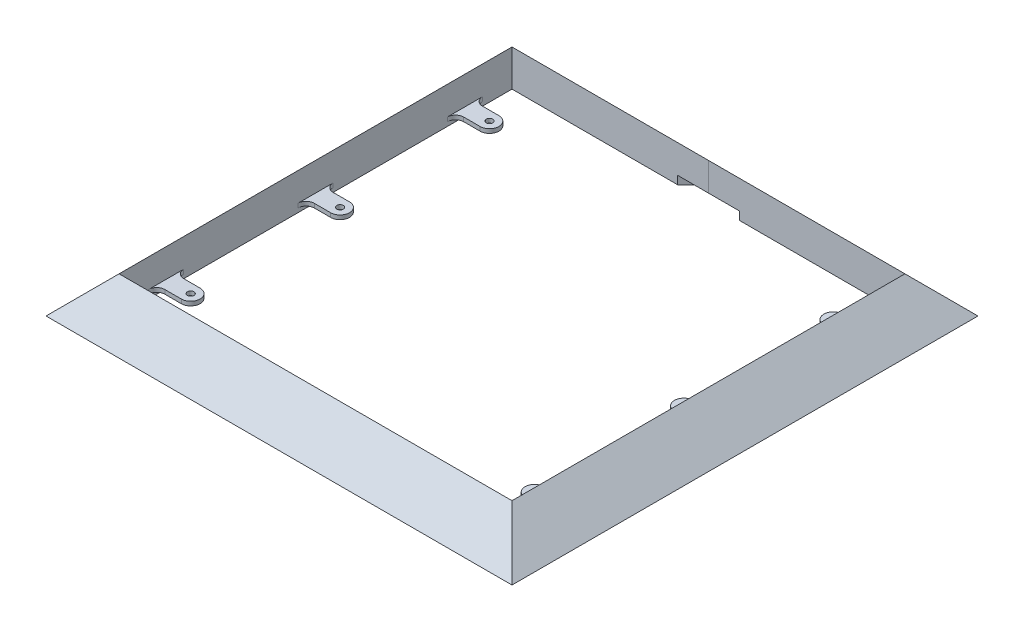
from build123d import *

# Parameters (mm, degrees)
SKETCH1_R               = 0.915
BOSS_EXTRUDE1_DEPTH     = 4.37
BOSS_EXTRUDE1_2_DEPTH   = 4.37
BOSS_EXTRUDE1_3_DEPTH   = 4.37
BOSS_EXTRUDE1_4_DEPTH   = 4.37
BOSS_EXTRUDE2_START     = 4.37
SKETCH1_3_R             = 4.7
SKETCH1_3_R_2           = 0.915
BOSS_EXTRUDE2_DEPTH     = 15
CUT_EXTRUDE1_DEPTH      = 245.162747978
SKETCH1_6_R             = 2.625
SKETCH1_6_R_2           = 0.75
CUT_EXTRUDE4_DEPTH      = 245.162747978
SKETCH5_R               = 1.6
BOSS_EXTRUDE4_DEPTH     = 2
LPATTERN1_COUNT         = 2
LPATTERN1_PITCH         = 73
LPATTERN1_COL_COUNT     = 2
LPATTERN1_COL_PITCH     = 73
MIRROR1_COPY_1_SKETCH_R = 1.6
MIRROR1_COPY_1_DEPTH    = 2
MIRROR1_COPY_2_SKETCH_R = 1.6
MIRROR1_COPY_2_DEPTH    = 2


with BuildPart() as part:
    # Sketch1 → Boss-Extrude1 (new body)
    with BuildSketch(Plane(origin=(0, 0, 0), x_dir=(1, 0, 0), z_dir=(0, 1, 0))):
        with Locations(Location((-1.117435623, 2.697728235, 0), (0, 0, 270))):
            Circle(SKETCH1_R)
    extrude(amount=BOSS_EXTRUDE1_DEPTH)



with BuildPart() as body_2:
    # Sketch1 → Boss-Extrude1 2 (new body)
    with BuildSketch(Plane(origin=(0, 0, 0), x_dir=(1, 0, 0), z_dir=(0, 1, 0))):
        with Locations(Location((-1.117435623, -2.697728235, 0), (0, 0, 270))):
            Circle(SKETCH1_R)
    extrude(amount=BOSS_EXTRUDE1_2_DEPTH)


with BuildPart() as body_3:
    # Sketch1 → Boss-Extrude1 3 (new body)
    with BuildSketch(Plane(origin=(0, 0, 0), x_dir=(1, 0, 0), z_dir=(0, 1, 0))):
        with Locations(Location((1.117435623, 2.697728235, 0), (0, 0, 270))):
            Circle(SKETCH1_R)
    extrude(amount=BOSS_EXTRUDE1_3_DEPTH)


with BuildPart() as body_4:
    # Sketch1 → Boss-Extrude1 4 (new body)
    with BuildSketch(Plane(origin=(0, 0, 0), x_dir=(1, 0, 0), z_dir=(0, 1, 0))):
        with Locations(Location((1.117435623, -2.697728235, 0), (0, 0, 270))):
            Circle(SKETCH1_R)
    extrude(amount=BOSS_EXTRUDE1_4_DEPTH)


with BuildPart() as part_1:
    add(part.part)

    add(body_2.part)  # Boss-Extrude2 merges body 2

    add(body_3.part)  # Boss-Extrude2 merges body 3

    add(body_4.part)  # Boss-Extrude2 merges body 4
    # Sketch1<3> → Boss-Extrude2 (add)
    # profile 1 of 5: a face of its own
    with BuildSketch(Plane(origin=(0, 0, 0), x_dir=(1, 0, 0), z_dir=(0, 1, 0)).offset(BOSS_EXTRUDE2_START)):
        with Locations(Location((0, 0, 0), (0, 0, 270))):
            Circle(SKETCH1_3_R)
        with Locations(Location((-1.117435623, -2.697728235, 0), (0, 0, 270))):
            Circle(SKETCH1_3_R_2, mode=Mode.SUBTRACT)
        with Locations(Location((1.117435623, -2.697728235, 0), (0, 0, 270))):
            Circle(SKETCH1_3_R_2, mode=Mode.SUBTRACT)
        with Locations(Location((1.117435623, 2.697728235, 0), (0, 0, 270))):
            Circle(SKETCH1_3_R_2, mode=Mode.SUBTRACT)
        with Locations(Location((-1.117435623, 2.697728235, 0), (0, 0, 270))):
            Circle(SKETCH1_3_R_2, mode=Mode.SUBTRACT)
    # profile 2 of 5: a face of its own
    with BuildSketch(Plane(origin=(0, 0, 0), x_dir=(1, 0, 0), z_dir=(0, 1, 0)).offset(BOSS_EXTRUDE2_START)):
        with Locations(Location((-1.117435623, -2.697728235, 0), (0, 0, 270))):
            Circle(SKETCH1_3_R_2)
    # profile 3 of 5: a face of its own
    with BuildSketch(Plane(origin=(0, 0, 0), x_dir=(1, 0, 0), z_dir=(0, 1, 0)).offset(BOSS_EXTRUDE2_START)):
        with Locations(Location((1.117435623, -2.697728235, 0), (0, 0, 270))):
            Circle(SKETCH1_3_R_2)
    # profile 4 of 5: a face of its own
    with BuildSketch(Plane(origin=(0, 0, 0), x_dir=(1, 0, 0), z_dir=(0, 1, 0)).offset(BOSS_EXTRUDE2_START)):
        with Locations(Location((1.117435623, 2.697728235, 0), (0, 0, 270))):
            Circle(SKETCH1_3_R_2)
    # profile 5 of 5: a face of its own
    with BuildSketch(Plane(origin=(0, 0, 0), x_dir=(1, 0, 0), z_dir=(0, 1, 0)).offset(BOSS_EXTRUDE2_START)):
        with Locations(Location((-1.117435623, 2.697728235, 0), (0, 0, 270))):
            Circle(SKETCH1_3_R_2)
    extrude(amount=BOSS_EXTRUDE2_DEPTH)


with BuildPart() as body_2_2:
    # Sweep1: sweep along a path in Sketch4
    with BuildLine(Plane(origin=(0, 0, 0), x_dir=(1, 0, 0), z_dir=(0, 1, 0))) as sweep1_path:
        Line((-96, -197.7), (96, -197.7))
        Line((96, -197.7), (96, -5.7))
        Line((96, -5.7), (-96, -5.7))
        Line((-96, -5.7), (-96, -197.7))
    # Sketch2 → Sweep1 (sweep)
    with BuildSketch(Plane(origin=(0, 0, 0), x_dir=(0, 0, -1), z_dir=(1, 0, 0))):
        Polygon((-5.7, -4), (-5.7, 13.85), (12.15, -4), align=None)
    sweep(path=sweep1_path.line, transition=Transition.RIGHT)

    # Combine2: cut part
    add(part_1.part, mode=Mode.SUBTRACT)

    # Sketch3 → Cut-Extrude1 (cut, through all)
    with BuildSketch(Plane(origin=(0, 0, 0), x_dir=(1, 0, 0), z_dir=(0, 1, 0))):
        Polygon((-15.05, -5.7), (15.05, -5.7), (4.35, 5), (-4.35, 5), align=None)
    extrude(amount=-CUT_EXTRUDE1_DEPTH, mode=Mode.SUBTRACT)

    # Sketch1<6> → Cut-Extrude4 (cut, through all)
    # profile 1 of 4: a face of its own
    with BuildSketch(Plane(origin=(0, 0, 0), x_dir=(1, 0, 0), z_dir=(0, 1, 0))):
        with Locations(Location((-7.4, -2.3, 0), (0, 0, 90))):
            Circle(SKETCH1_6_R)
    # profile 2 of 4: a face of its own
    with BuildSketch(Plane(origin=(0, 0, 0), x_dir=(1, 0, 0), z_dir=(0, 1, 0))):
        with Locations(Location((7.4, -2.3, 0), (0, 0, 90))):
            Circle(SKETCH1_6_R)
        with Locations((8.9, -2.3)):
            Circle(SKETCH1_6_R_2, mode=Mode.SUBTRACT)
        with Locations((5.9, -2.3)):
            Circle(SKETCH1_6_R_2, mode=Mode.SUBTRACT)
    # profile 3 of 4: a face of its own
    with BuildSketch(Plane(origin=(0, 0, 0), x_dir=(1, 0, 0), z_dir=(0, 1, 0))):
        with Locations((5.9, -2.3)):
            Circle(SKETCH1_6_R_2)
    # profile 4 of 4: a face of its own
    with BuildSketch(Plane(origin=(0, 0, 0), x_dir=(1, 0, 0), z_dir=(0, 1, 0))):
        with Locations((8.9, -2.3)):
            Circle(SKETCH1_6_R_2)
    extrude(amount=CUT_EXTRUDE4_DEPTH, mode=Mode.SUBTRACT)

    # Sketch5 → Boss-Extrude4 (add)
    with BuildSketch(Plane(origin=(0, 0, 0), x_dir=(1, 0, 0), z_dir=(0, 1, 0))):
        with BuildLine():
            ThreePointArc((-84, -106.3), (-79.4, -101.7), (-84, -97.1))
            Line((-84, -97.1), (-92, -97.1))
            ThreePointArc((-92, -97.1), (-94.828427125, -95.928427125), (-96, -93.1))
            Line((-96, -93.1), (-96, -110.3))
            ThreePointArc((-96, -110.3), (-94.828427125, -107.471572875), (-92, -106.3))
            Line((-92, -106.3), (-84, -106.3))
        make_face()
        with Locations(Location((-84, -101.7, 0), (0, 0, 270))):
            Circle(SKETCH5_R, mode=Mode.SUBTRACT)
    boss_extrude4 = extrude(amount=-BOSS_EXTRUDE4_DEPTH)

    # LPattern1: Boss-Extrude4 ×2
    with Locations(*[(0, 0, -i * LPATTERN1_PITCH) for i in range(1, LPATTERN1_COUNT)]):
        add(boss_extrude4)

    # LPattern1 col: Boss-Extrude4 ×2
    with Locations(*[(0, 0, i * LPATTERN1_COL_PITCH) for i in range(1, LPATTERN1_COL_COUNT)]):
        add(boss_extrude4)

    # Mirror1: Boss-Extrude4 across plane
    add(boss_extrude4.mirror(Plane(origin=(0, 0, 0), x_dir=(0, 0, 1), z_dir=(1, 0, 0))))

    # Mirror1 copy 1 sketch → Mirror1 copy 1 (add)
    with BuildSketch(Plane(origin=(0, 0, -73), x_dir=(-1, 0, 0), z_dir=(0, 1, 0))):
        with BuildLine():
            ThreePointArc((-84, 106.3), (-79.4, 101.7), (-84, 97.1))
            Line((-84, 97.1), (-92, 97.1))
            ThreePointArc((-92, 97.1), (-94.828427125, 95.928427125), (-96, 93.1))
            Line((-96, 93.1), (-96, 110.3))
            ThreePointArc((-96, 110.3), (-94.828427125, 107.471572875), (-92, 106.3))
            Line((-92, 106.3), (-84, 106.3))
        make_face()
        with Locations((-84, 101.7)):
            Circle(MIRROR1_COPY_1_SKETCH_R, mode=Mode.SUBTRACT)
    extrude(amount=-MIRROR1_COPY_1_DEPTH)

    # Mirror1 copy 2 sketch → Mirror1 copy 2 (add)
    with BuildSketch(Plane(origin=(0, 0, 73), x_dir=(-1, 0, 0), z_dir=(0, 1, 0))):
        with BuildLine():
            ThreePointArc((-84, 106.3), (-79.4, 101.7), (-84, 97.1))
            Line((-84, 97.1), (-92, 97.1))
            ThreePointArc((-92, 97.1), (-94.828427125, 95.928427125), (-96, 93.1))
            Line((-96, 93.1), (-96, 110.3))
            ThreePointArc((-96, 110.3), (-94.828427125, 107.471572875), (-92, 106.3))
            Line((-92, 106.3), (-84, 106.3))
        make_face()
        with Locations((-84, 101.7)):
            Circle(MIRROR1_COPY_2_SKETCH_R, mode=Mode.SUBTRACT)
    extrude(amount=-MIRROR1_COPY_2_DEPTH)


solid = body_2_2.part
